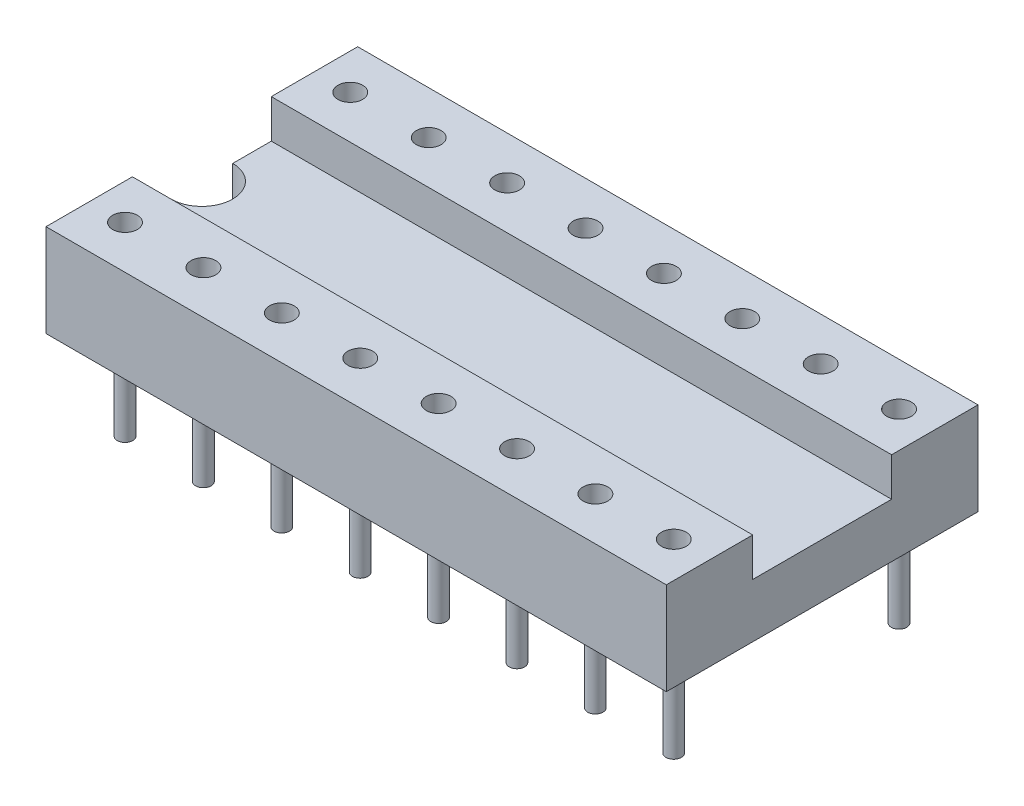
from build123d import *

# Parameters (mm, degrees)
EXTRUSION1_DEPTH        = 20.1
ENL_V_MAT_EXTRU_1_DEPTH = 21.798437441
ESQUISSE3_R             = 0.4
ENL_V_MAT_EXTRU_2_DEPTH = 2.5
ESQUISSE5_R             = 0.25
EXTRUSION2_DEPTH        = 3


with BuildPart() as part:
    # Esquisse1 → Extrusion1 (new body)
    with BuildSketch(Plane(origin=(0, 0, 0), x_dir=(0, 0, -1), z_dir=(1, 0, 0))):
        Polygon((-2.25, 1.75), (-2.25, 3), (-5.05, 3), (-5.05, 0), (5.05, 0), (5.05, 3), (2.25, 3), (2.25, 1.75), align=None)
    extrude(amount=EXTRUSION1_DEPTH)

    # Esquisse2 → Enlèv. mat.-Extru.1 (cut, through all)
    with BuildSketch(Plane(origin=(0, 1.75, 0), x_dir=(-1, 0, 0), z_dir=(0, 1, 0))):
        with BuildLine():
            Line((0, -1), (0, 1))
            ThreePointArc((0, 1), (-1, 0), (0, -1))
        make_face()
    extrude(amount=-ENL_V_MAT_EXTRU_1_DEPTH, mode=Mode.SUBTRACT)

    # Esquisse3 → Enlèv. mat.-Extru.2 (cut)
    with BuildSketch(Plane(origin=(0, 3, 0), x_dir=(-1, 0, 0), z_dir=(0, 1, 0))):
        with Locations(Location((-1.16, 3.65, 0), (0, 0, 90))):
            Circle(ESQUISSE3_R)
        with Locations(Location((-1.16, -3.65, 0), (0, 0, 270))):
            Circle(ESQUISSE3_R)
        with Locations(Location((-3.701, 3.65, 0), (0, 0, 90))):
            Circle(ESQUISSE3_R)
        with Locations(Location((-3.701, -3.65, 0), (0, 0, 270))):
            Circle(ESQUISSE3_R)
        with Locations(Location((-6.242, 3.65, 0), (0, 0, 90))):
            Circle(ESQUISSE3_R)
        with Locations(Location((-6.242, -3.65, 0), (0, 0, 270))):
            Circle(ESQUISSE3_R)
        with Locations(Location((-8.783, 3.65, 0), (0, 0, 90))):
            Circle(ESQUISSE3_R)
        with Locations(Location((-8.783, -3.65, 0), (0, 0, 270))):
            Circle(ESQUISSE3_R)
        with Locations(Location((-11.323, 3.65, 0), (0, 0, 90))):
            Circle(ESQUISSE3_R)
        with Locations(Location((-11.323, -3.65, 0), (0, 0, 270))):
            Circle(ESQUISSE3_R)
        with Locations(Location((-13.863, 3.65, 0), (0, 0, 90))):
            Circle(ESQUISSE3_R)
        with Locations(Location((-13.863, -3.65, 0), (0, 0, 270))):
            Circle(ESQUISSE3_R)
        with Locations(Location((-16.403, 3.65, 0), (0, 0, 90))):
            Circle(ESQUISSE3_R)
        with Locations(Location((-16.403, -3.65, 0), (0, 0, 270))):
            Circle(ESQUISSE3_R)
        with Locations(Location((-18.943, 3.65, 0), (0, 0, 90))):
            Circle(ESQUISSE3_R)
        with Locations(Location((-18.943, -3.65, 0), (0, 0, 270))):
            Circle(ESQUISSE3_R)
    extrude(amount=-ENL_V_MAT_EXTRU_2_DEPTH, mode=Mode.SUBTRACT)

    # Esquisse5 → Extrusion2 (add)
    with BuildSketch(Plane.XZ):
        with Locations(Location((1.16, 3.65, 0), (0, 0, 90))):
            Circle(ESQUISSE5_R)
        with Locations(Location((1.16, -3.65, 0), (0, 0, 90))):
            Circle(ESQUISSE5_R)
        with Locations(Location((3.7, -3.65, 0), (0, 0, 90))):
            Circle(ESQUISSE5_R)
        with Locations(Location((3.7, 3.65, 0), (0, 0, 90))):
            Circle(ESQUISSE5_R)
        with Locations(Location((6.24, -3.65, 0), (0, 0, 90))):
            Circle(ESQUISSE5_R)
        with Locations(Location((6.24, 3.65, 0), (0, 0, 90))):
            Circle(ESQUISSE5_R)
        with Locations(Location((8.78, -3.65, 0), (0, 0, 90))):
            Circle(ESQUISSE5_R)
        with Locations(Location((8.78, 3.65, 0), (0, 0, 90))):
            Circle(ESQUISSE5_R)
        with Locations(Location((11.32, -3.65, 0), (0, 0, 90))):
            Circle(ESQUISSE5_R)
        with Locations(Location((11.32, 3.65, 0), (0, 0, 90))):
            Circle(ESQUISSE5_R)
        with Locations(Location((13.86, -3.65, 0), (0, 0, 90))):
            Circle(ESQUISSE5_R)
        with Locations(Location((13.86, 3.65, 0), (0, 0, 90))):
            Circle(ESQUISSE5_R)
        with Locations(Location((16.4, -3.65, 0), (0, 0, 90))):
            Circle(ESQUISSE5_R)
        with Locations(Location((16.4, 3.65, 0), (0, 0, 90))):
            Circle(ESQUISSE5_R)
        with Locations(Location((18.94, -3.65, 0), (0, 0, 90))):
            Circle(ESQUISSE5_R)
        with Locations(Location((18.94, 3.65, 0), (0, 0, 90))):
            Circle(ESQUISSE5_R)
    extrude(amount=EXTRUSION2_DEPTH)


solid = part.part
